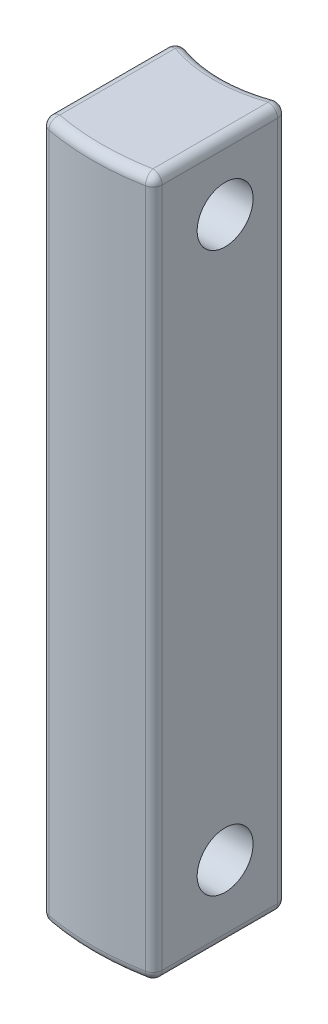
from build123d import *

# Parameters (mm, degrees)
EXTRUDE_1_DEPTH          = 37.5
CUT_EXTRUDE_1_DEPTH      = 48.600948443
CUT_EXTRUDE_1_DEPTH_BACK = 48.600948443
SKETCH_2_R               = 3
FILLET_1_R               = 1


with BuildPart() as part:
    # 草图1 → 凸台-拉伸1 (new, symmetric)
    with BuildSketch(Plane(origin=(0, 0, 0), x_dir=(1, 0, 0), z_dir=(0, 1, 0))):
        with BuildLine():
            Line((-6, -13.347547753), (-6, -28.048025774))
            ThreePointArc((-6, -28.048025774), (0, -28.698437112), (6, -28.048025774))
            Line((6, -28.048025774), (6, -13.347547753))
            ThreePointArc((6, -13.347547753), (0, -14.698437112), (-6, -13.347547753))
        make_face()
    extrude(amount=EXTRUDE_1_DEPTH, both=True)

    # 草图2 → 切除-拉伸1 (cut, two sides: drawn at the far end of the back side and taken through both)
    with BuildSketch(Plane(origin=(0, 0, 0), x_dir=(0, 0, -1), z_dir=(1, 0, 0)).offset(-CUT_EXTRUDE_1_DEPTH_BACK)):
        with Locations((-20.475498544, 30.367818126)):
            Circle(SKETCH_2_R)
        with Locations((-20.475498544, -29.632181874)):
            Circle(SKETCH_2_R)
    extrude(amount=CUT_EXTRUDE_1_DEPTH + CUT_EXTRUDE_1_DEPTH_BACK, mode=Mode.SUBTRACT)

    # 圆角1
    fillet_1_edges = [part.edges().sort_by_distance(p)[0] for p in [
        (0, 37.5, 28.698437112),
        (6, 37.5, 20.697786763),
        (0, 37.5, 14.698437112),
        (6, -37.5, 20.697786763),
        (0, -37.5, 28.698437112),
        (-6, -37.5, 20.697786763),
        (0, -37.5, 14.698437112),
        (6, 0, 13.347547753),
        (6, 0, 28.048025774),
        (-6, 0, 28.048025774),
        (-6, 0, 13.347547753),
        (-6, 37.5, 20.697786763),
    ]]
    fillet(fillet_1_edges, radius=FILLET_1_R)


solid = part.part
